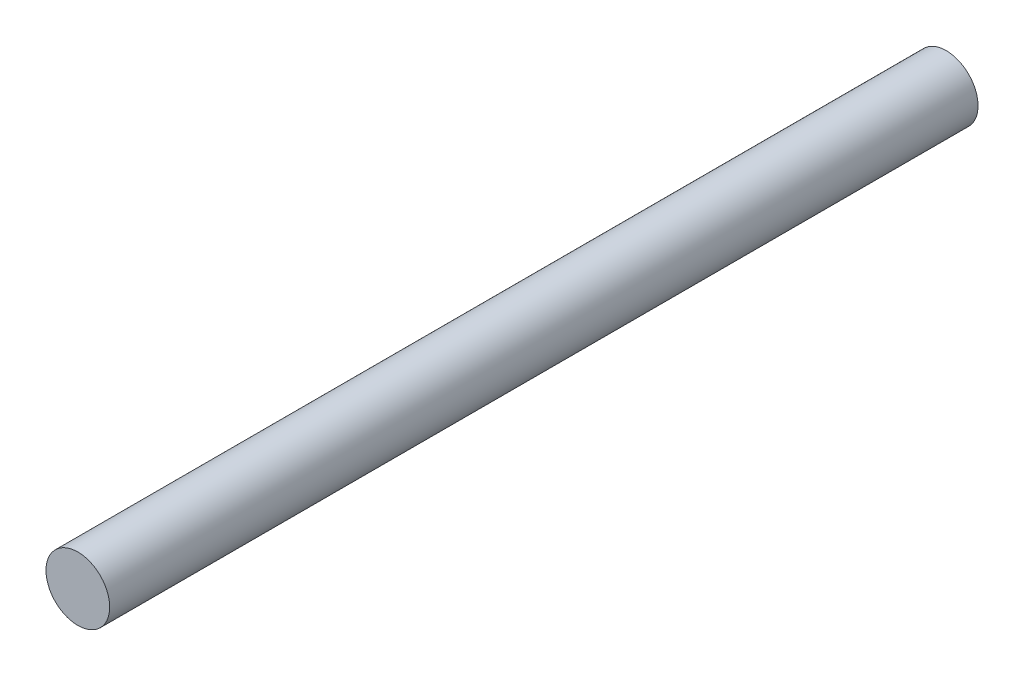
from build123d import *

# Parameters (mm, degrees)
SKETCH1_R           = 3.3
BOSS_EXTRUDE1_DEPTH = 90


with BuildPart() as part:
    # Sketch1 → Boss-Extrude1 (new body)
    with BuildSketch(Plane.XY):
        Circle(SKETCH1_R)
    extrude(amount=BOSS_EXTRUDE1_DEPTH)


solid = part.part
